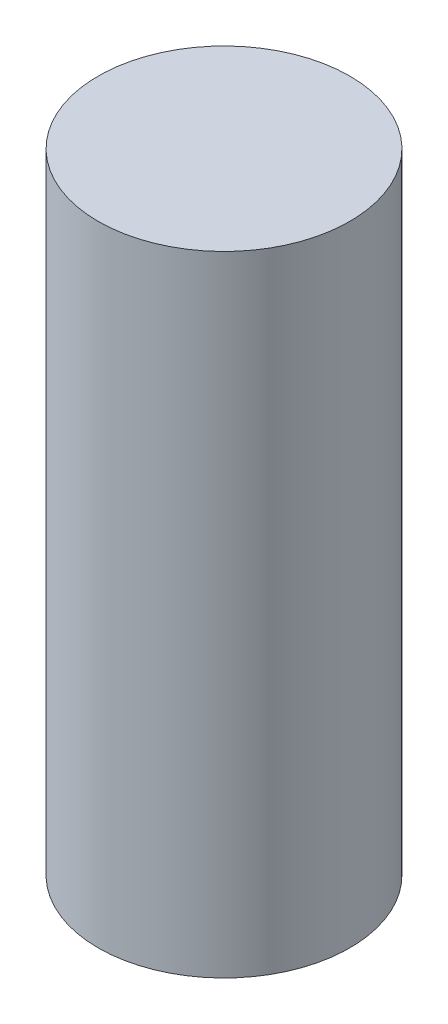
from build123d import *

# Parameters (mm, degrees)
ESQUISSE1_R        = 5
BOSS_EXTRU_1_DEPTH = 12.5


with BuildPart() as part:
    # Esquisse1 → Boss.-Extru.1 (new, symmetric)
    with BuildSketch(Plane(origin=(0, 0, 0), x_dir=(1, 0, 0), z_dir=(0, 1, 0))):
        with Locations(Location((0, 0, 0), (0, 0, 270))):
            Circle(ESQUISSE1_R)
    extrude(amount=BOSS_EXTRU_1_DEPTH, both=True)


solid = part.part
